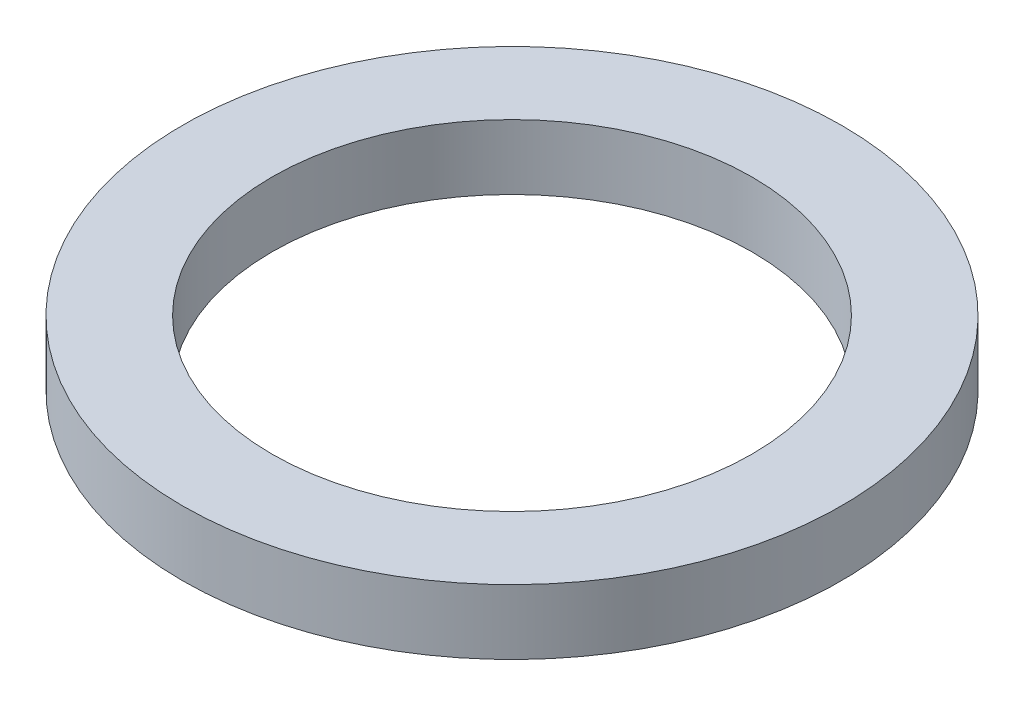
from build123d import *

# Parameters (mm, degrees)
SKETCH1_R           = 25.4
SKETCH1_R_2         = 18.5
BOSS_EXTRUDE1_DEPTH = 5


with BuildPart() as part:
    # Sketch1 → Boss-Extrude1 (new body)
    with BuildSketch(Plane(origin=(0, 0, 0), x_dir=(1, 0, 0), z_dir=(0, 1, 0))):
        with Locations(Location((0, 0, 0), (0, 0, 270))):
            Circle(SKETCH1_R)
        with Locations(Location((0, 0, 0), (0, 0, 270))):
            Circle(SKETCH1_R_2, mode=Mode.SUBTRACT)
    extrude(amount=BOSS_EXTRUDE1_DEPTH)


solid = part.part
